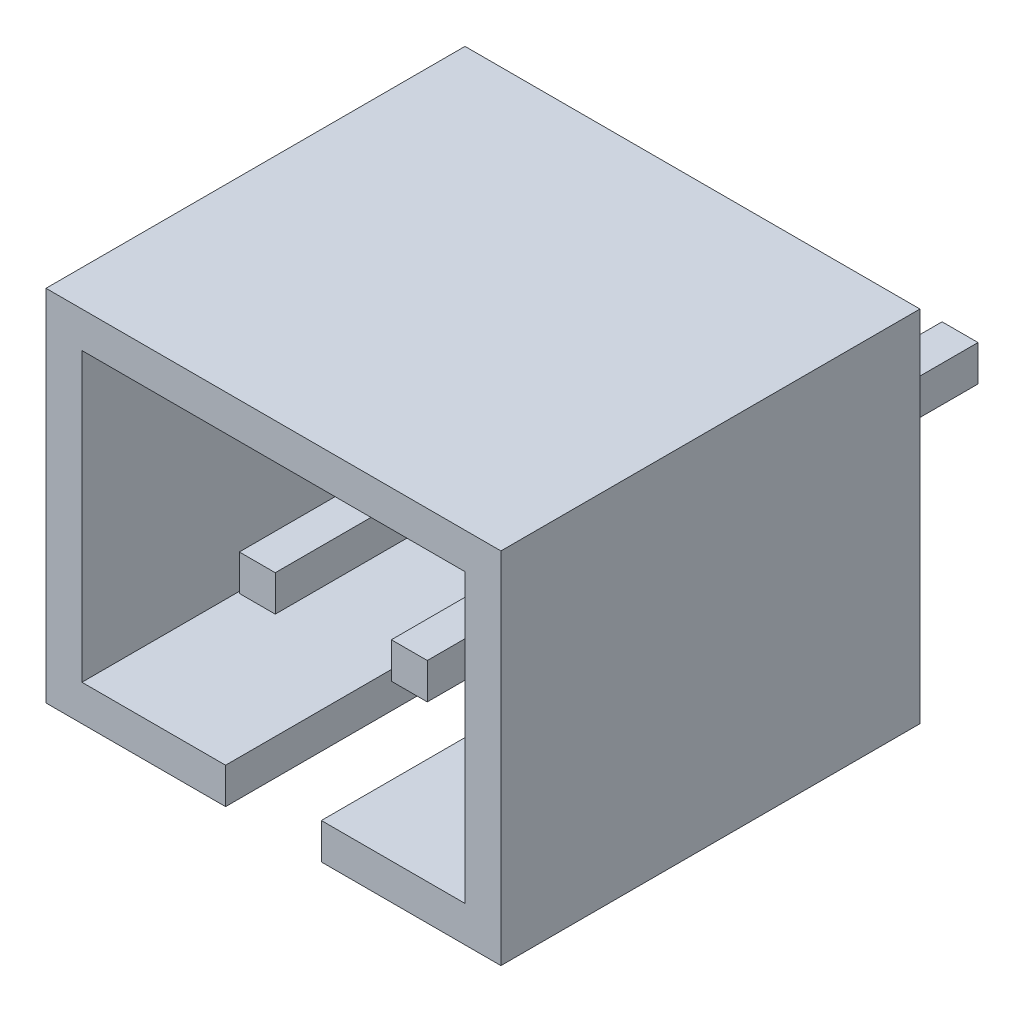
from build123d import *

# Parameters (mm, degrees)
SKETCH1_W           = 7.6
SKETCH1_H           = 6
BOSS_EXTRUDE1_DEPTH = 1.8
BOSS_EXTRUDE2_DEPTH = 5.2
BOSS_EXTRUDE3_START = -5
SKETCH3_W           = 0.6
SKETCH3_H           = 0.6
BOSS_EXTRUDE3_DEPTH = 9.2
LPATTERN1_COUNT     = 2
LPATTERN1_PITCH     = 2.54


with BuildPart() as part:
    # Sketch1 → Boss-Extrude1 (new body)
    with BuildSketch(Plane.XY):
        Rectangle(SKETCH1_W, SKETCH1_H)
    extrude(amount=BOSS_EXTRUDE1_DEPTH)

    # Sketch2 → Boss-Extrude2 (add)
    with BuildSketch(Plane.XY.offset(1.8)):
        Polygon((-0.8, -3), (-0.8, -2.4), (-3.2, -2.4), (-3.2, 2.4), (3.2, 2.4), (3.2, -2.4), (0.8, -2.4), (0.8, -3), (3.8, -3), (3.8, 3), (-3.8, 3), (-3.8, -3), align=None)
    extrude(amount=BOSS_EXTRUDE2_DEPTH)

    # Sketch3 → Boss-Extrude3 (add)
    with BuildSketch(Plane.XY.offset(1.8).offset(BOSS_EXTRUDE3_START)):
        with Locations((-1.27, -0.5)):
            Rectangle(SKETCH3_W, SKETCH3_H)
    boss_extrude3 = extrude(amount=BOSS_EXTRUDE3_DEPTH)

    # LPattern1: Boss-Extrude3 ×2
    with Locations(*[(i * LPATTERN1_PITCH, 0, 0) for i in range(1, LPATTERN1_COUNT)]):
        add(boss_extrude3)


solid = part.part
